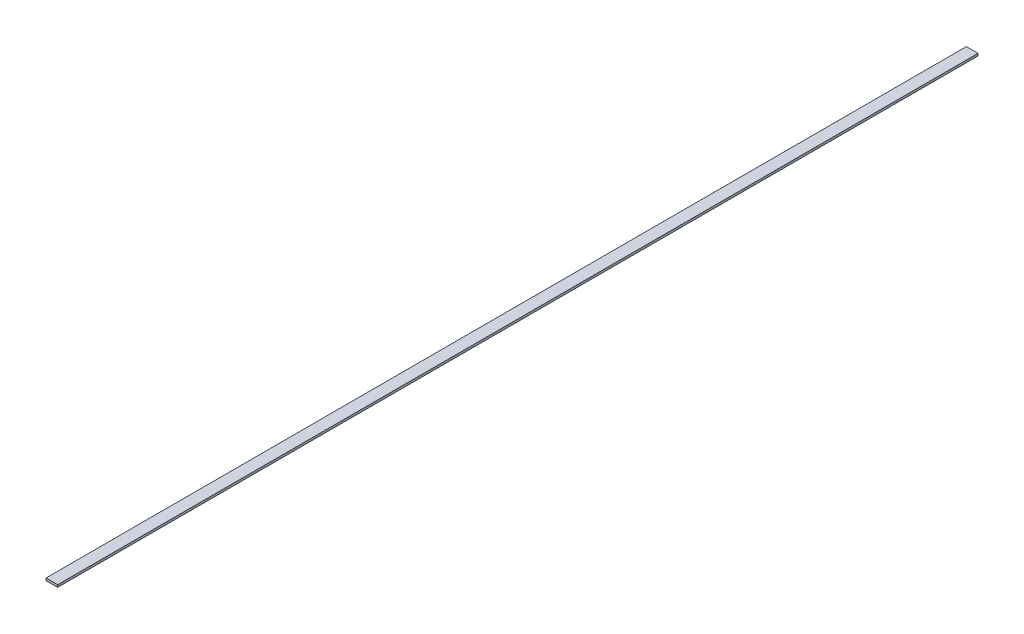
from build123d import *

# Parameters (mm, degrees)
SKETCH1_W           = 25.4
SKETCH1_H           = 5.08
BOSS_EXTRUDE1_DEPTH = 2006.6


with BuildPart() as part:
    # Sketch1 → Boss-Extrude1 (new body)
    with BuildSketch(Plane.XY):
        with Locations((5.715, -0.105833333)):
            Rectangle(SKETCH1_W, SKETCH1_H)
    extrude(amount=BOSS_EXTRUDE1_DEPTH)


solid = part.part
